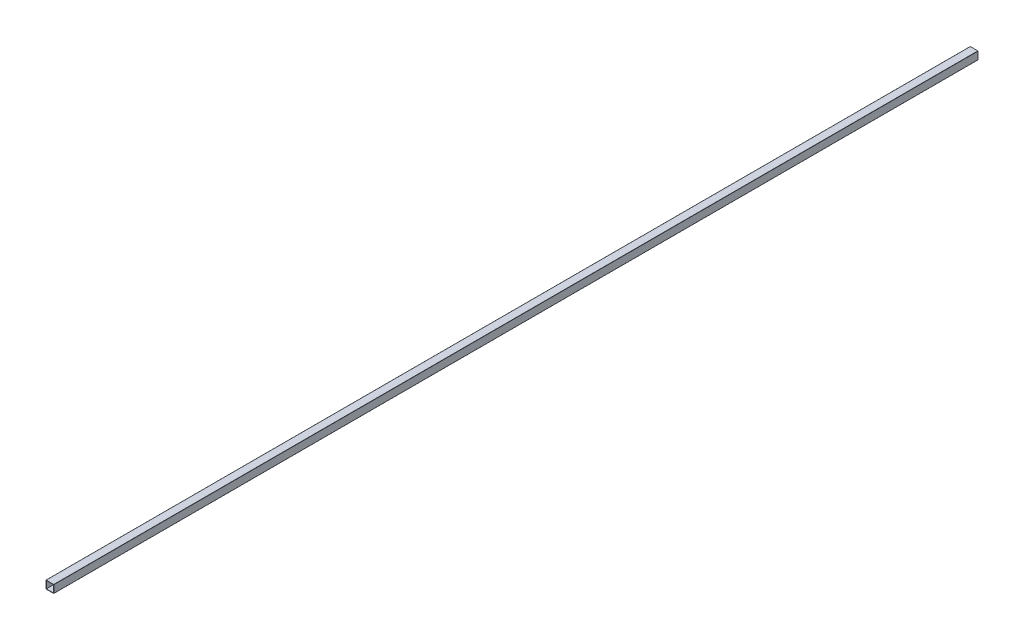
from build123d import *

# Parameters (mm, degrees)
CROQUIS1_W              = 47.02
CROQUIS1_H              = 47.02
SALIENTE_EXTRUIR1_DEPTH = 6000


with BuildPart() as part:
    # Croquis1 → Saliente-Extruir1 (new body)
    with BuildSketch(Plane.XY):
        with BuildLine():
            Line((-24.4, -25.4), (24.4, -25.4))
            ThreePointArc((24.4, -25.4), (25.107106781, -25.107106781), (25.4, -24.4))
            Line((25.4, -24.4), (25.4, 24.4))
            ThreePointArc((25.4, 24.4), (25.107106781, 25.107106781), (24.4, 25.4))
            Line((24.4, 25.4), (-24.4, 25.4))
            ThreePointArc((-24.4, 25.4), (-25.107106781, 25.107106781), (-25.4, 24.4))
            Line((-25.4, 24.4), (-25.4, -24.4))
            ThreePointArc((-25.4, -24.4), (-25.107106781, -25.107106781), (-24.4, -25.4))
        make_face()
        Rectangle(CROQUIS1_W, CROQUIS1_H, mode=Mode.SUBTRACT)
    extrude(amount=SALIENTE_EXTRUIR1_DEPTH)


solid = part.part
